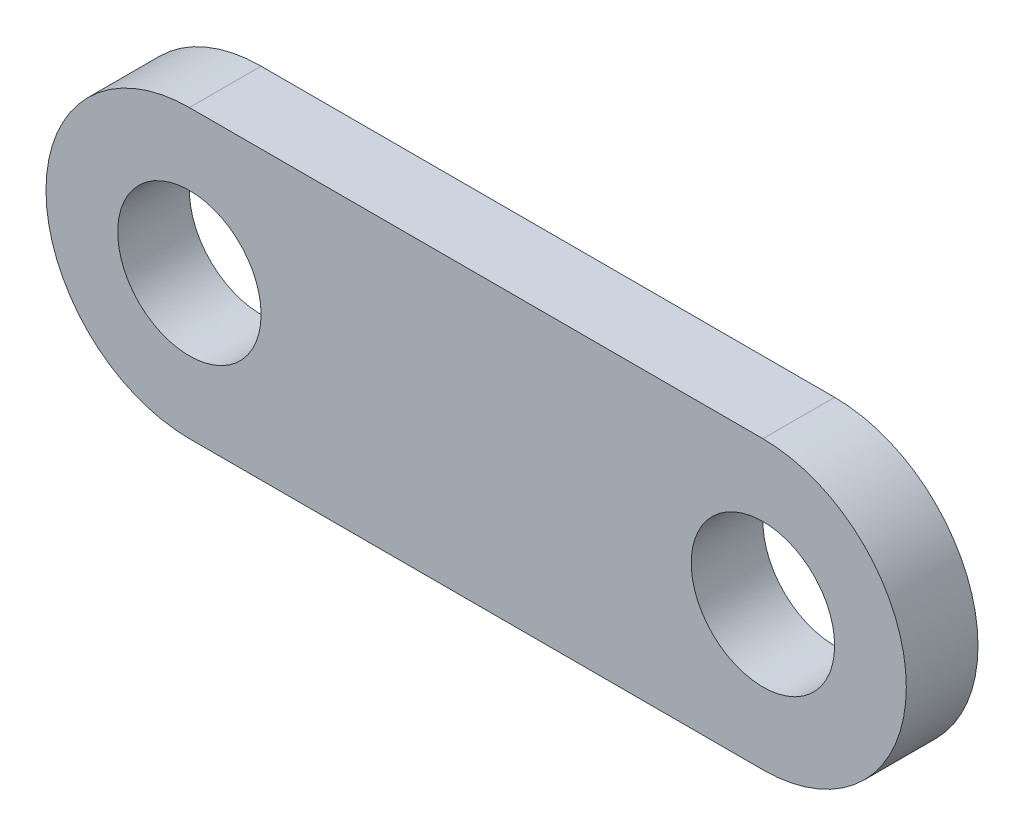
from build123d import *

# Parameters (mm, degrees)
SKETCH1_R           = 5
BOSS_EXTRUDE1_DEPTH = 5


with BuildPart() as part:
    # Sketch1 → Boss-Extrude1 (new body)
    with BuildSketch(Plane.XY):
        with BuildLine():
            Line((20, -10), (-20, -10))
            ThreePointArc((-20, -10), (-30, 0), (-20, 10))
            Line((-20, 10), (20, 10))
            ThreePointArc((20, 10), (30, 0), (20, -10))
        make_face()
        with Locations((-20, 0)):
            Circle(SKETCH1_R, mode=Mode.SUBTRACT)
        with Locations((20, 0)):
            Circle(SKETCH1_R, mode=Mode.SUBTRACT)
    extrude(amount=BOSS_EXTRUDE1_DEPTH)


solid = part.part
